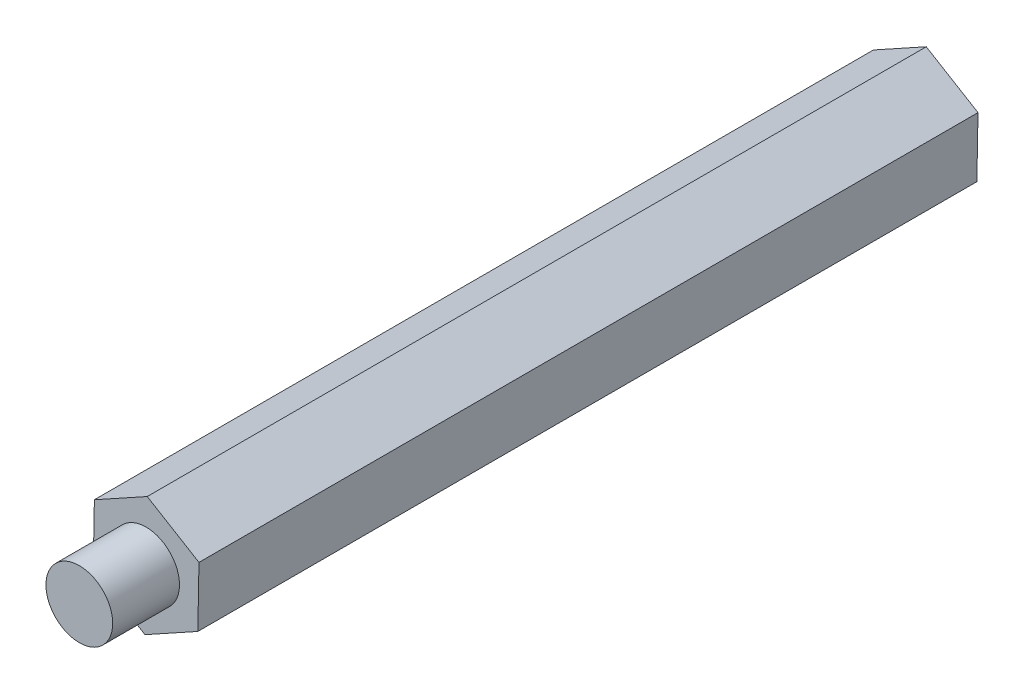
from build123d import *

# Parameters (mm, degrees)
EXTRUDE_1_DEPTH     = 35
SKETCH_2_R          = 1.5
EXTRUDE_2_DEPTH     = 3
SKETCH_3_R          = 1.5
CUT_EXTRUDE_1_DEPTH = 3


with BuildPart() as part:
    # 草图1 → 凸台-拉伸1 (new body)
    with BuildSketch(Plane.XY):
        Polygon((-2.324213399, 1.400487561), (-2.374964505, -1.312584067), (-0.050751106, -2.713071628), (2.324213399, -1.400487561), (2.374964505, 1.312584067), (0.050751106, 2.713071628), align=None)
    extrude(amount=EXTRUDE_1_DEPTH)

    # 草图2 → 凸台-拉伸2 (add)
    with BuildSketch(Plane.XY.offset(35)):
        Circle(SKETCH_2_R)
    extrude(amount=EXTRUDE_2_DEPTH)

    # 草图3 → 切除-拉伸1 (cut)
    with BuildSketch(Plane(origin=(0, 0, 0), x_dir=(-1, 0, 0), z_dir=(0, 0, -1))):
        with Locations(Location((0, 0, 0), (0, 0, 180))):
            Circle(SKETCH_3_R)
    extrude(amount=-CUT_EXTRUDE_1_DEPTH, mode=Mode.SUBTRACT)


solid = part.part
